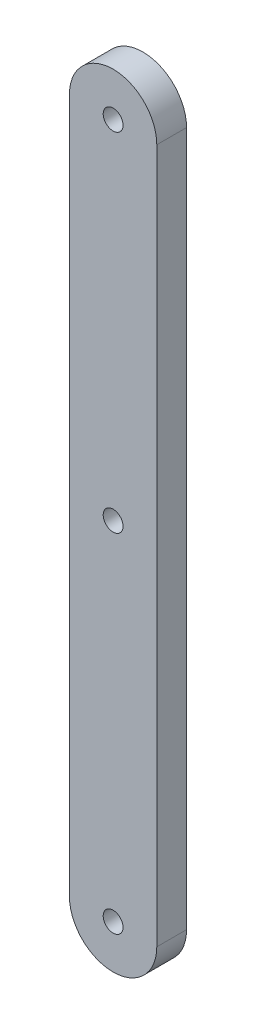
from build123d import *

# Parameters (mm, degrees)
BOSS_EXTRUDE1_DEPTH = 3
SKETCH6_R           = 1
CUT_EXTRUDE1_DEPTH  = 3
CHAMFER1_SIZE       = 1.25


with BuildPart() as part:
    # Sketch1 → Boss-Extrude1 (new body)
    with BuildSketch(Plane(origin=(0, 0, 0), x_dir=(0, 1, 0), z_dir=(0, 0, 1))):
        with BuildLine():
            Line((-35, 4.4), (35, 4.4))
            ThreePointArc((35, 4.4), (39.4, 0), (35, -4.4))
            Line((35, -4.4), (-35, -4.4))
            ThreePointArc((-35, -4.4), (-39.4, 0), (-35, 4.4))
        make_face()
    extrude(amount=BOSS_EXTRUDE1_DEPTH)

    # Sketch6 → Cut-Extrude1 (cut)
    with BuildSketch(Plane.XY.offset(3)):
        with Locations((0, 35)):
            Circle(SKETCH6_R)
        with Locations((0, -35)):
            Circle(SKETCH6_R)
        Circle(SKETCH6_R)
    extrude(amount=-CUT_EXTRUDE1_DEPTH, mode=Mode.SUBTRACT)

    # Chamfer1
    chamfer1_edges = [part.edges().sort_by_distance(p)[0] for p in [
        (-1, 35, 0),
        (-1, -35, 0),
        (-1, 0, 0),
    ]]
    chamfer(chamfer1_edges, length=CHAMFER1_SIZE)


solid = part.part
